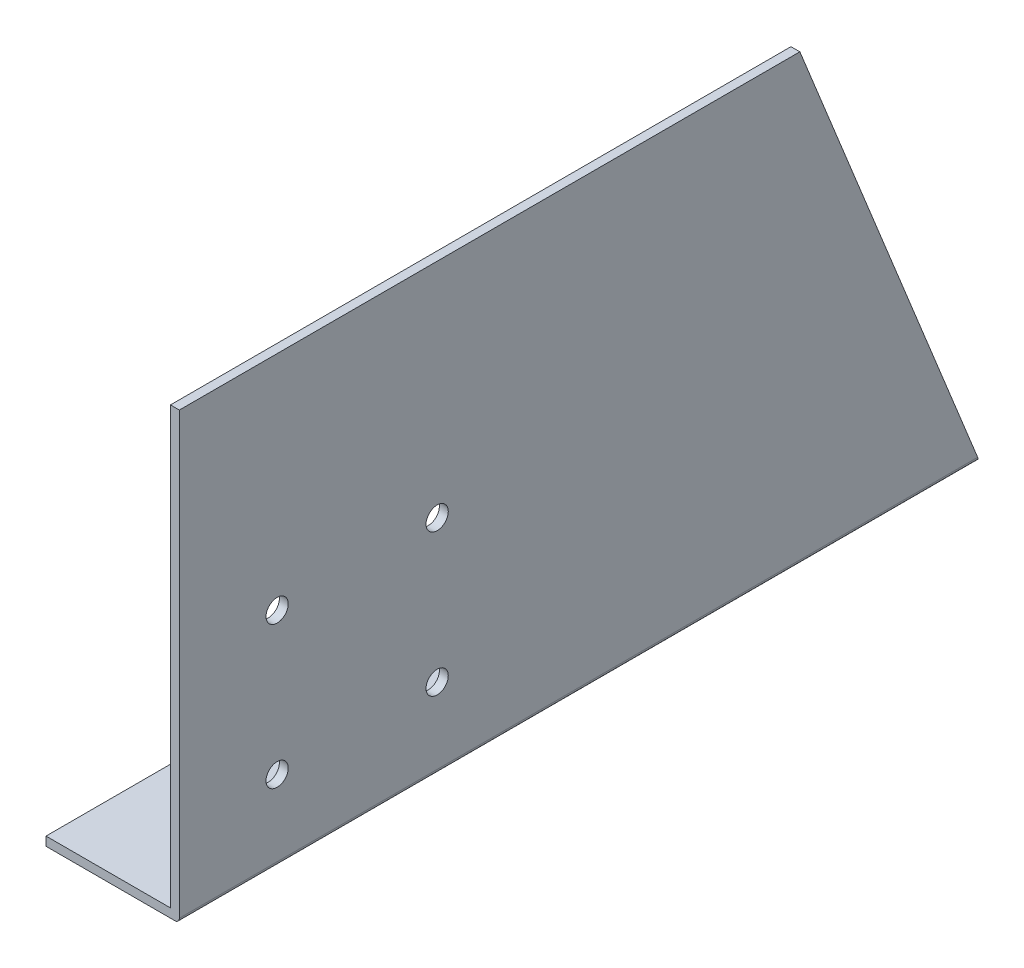
from build123d import *

# Parameters (mm, degrees)
BOSS_EXTRUDE1_DEPTH = 180
SKETCH2_R           = 2.5
CUT_EXTRUDE1_DEPTH  = 180
FILLET1_R           = 1


with BuildPart() as part:
    # Sketch1 → Boss-Extrude1 (new body)
    with BuildSketch(Plane.XY):
        Polygon((0, 0), (30, 0), (30, 100), (28, 100), (28, 2), (0, 2), align=None)
    extrude(amount=BOSS_EXTRUDE1_DEPTH)

    # Sketch2 → Cut-Extrude1 (cut)
    with BuildSketch(Plane(origin=(30, 0, 0), x_dir=(0, 0, -1), z_dir=(1, 0, 0))):
        with Locations((-122, 50)):
            Circle(SKETCH2_R)
        with Locations((-122, 18)):
            Circle(SKETCH2_R)
        with Locations((-158, 18)):
            Circle(SKETCH2_R)
        with Locations((-158, 50)):
            Circle(SKETCH2_R)
        Polygon((0, 0), (0, 100), (-40.402622584, 100), align=None)
    extrude(amount=-CUT_EXTRUDE1_DEPTH, mode=Mode.SUBTRACT)

    # Fillet1
    fillet1_edges = [part.edges().sort_by_distance(p)[0] for p in [
        (30, 0, 90),
    ]]
    fillet(fillet1_edges, radius=FILLET1_R)


solid = part.part
